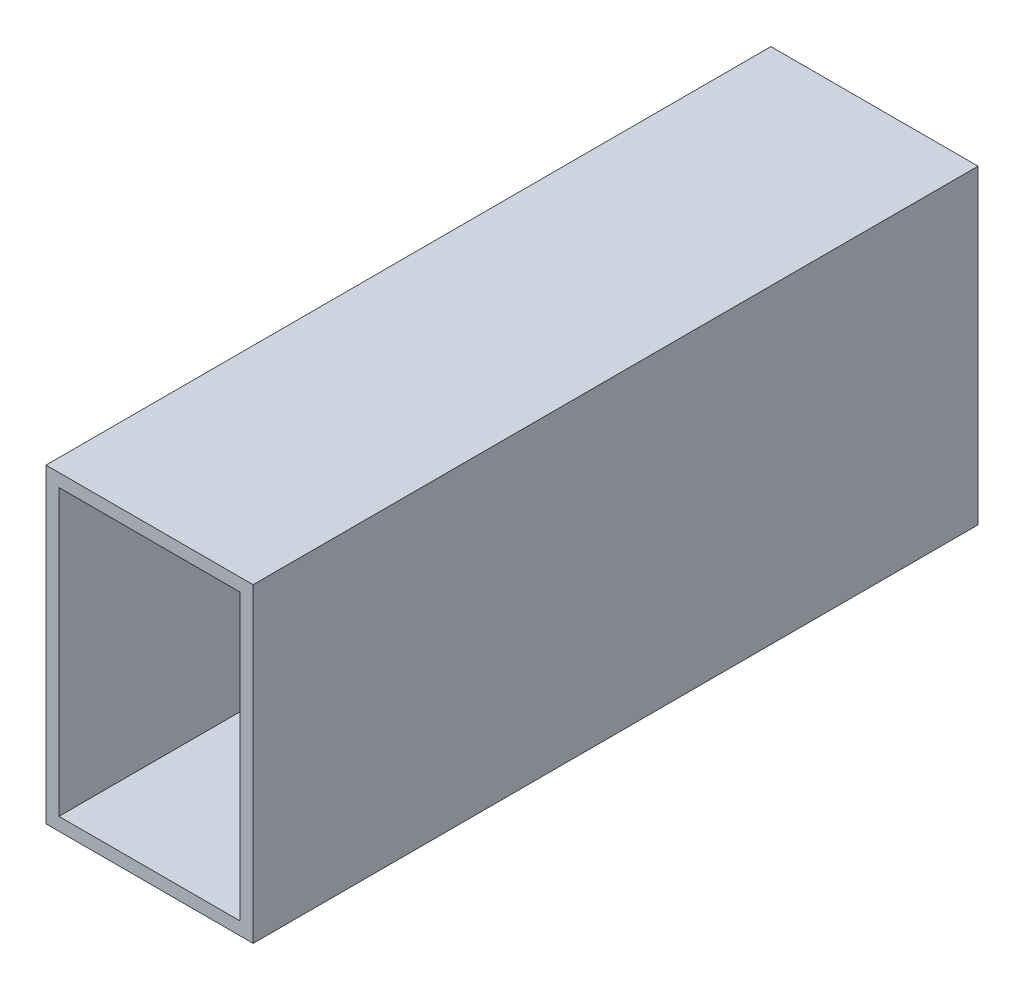
from build123d import *

# Parameters (mm, degrees)
SKETCH1_W           = 50.8
SKETCH1_H           = 76.2
SKETCH1_W_2         = 44.45
SKETCH1_H_2         = 69.85
BOSS_EXTRUDE1_DEPTH = 177.8


with BuildPart() as part:
    # Sketch1 → Boss-Extrude1 (new body)
    with BuildSketch(Plane.XY):
        Rectangle(SKETCH1_W, SKETCH1_H)
        Rectangle(SKETCH1_W_2, SKETCH1_H_2, mode=Mode.SUBTRACT)
    extrude(amount=BOSS_EXTRUDE1_DEPTH)


solid = part.part
